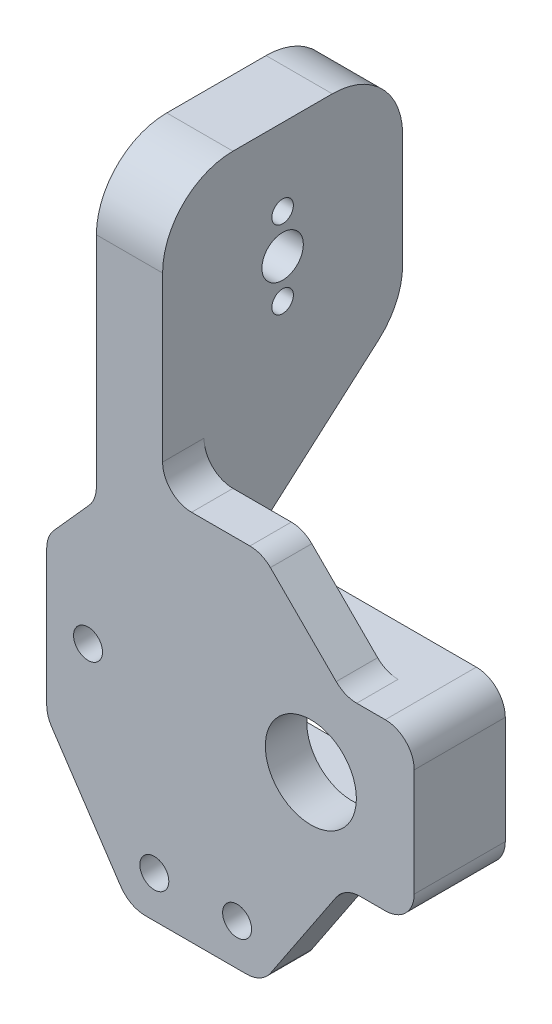
from build123d import *

# Parameters (mm, degrees)
SKETCH2_R           = 5.5
SKETCH2_R_2         = 1.750005389
SKETCH2_R_3         = 1.749978063
SKETCH2_R_4         = 1.749044057
BOSS_EXTRUDE1_DEPTH = 5
BOSS_EXTRUDE2_START = 6
SKETCH3_R           = 1
SKETCH3_W           = 23
SKETCH3_H           = 11.999999553
BOSS_EXTRUDE2_DEPTH = 6
SKETCH4_W           = 8.00000038
SKETCH4_H           = 26
BOSS_EXTRUDE3_DEPTH = 18
BOSS_EXTRUDE4_DEPTH = 4
FILLET1_R           = 8.5
SKETCH6_R           = 2.5
SKETCH6_R_2         = 1.3
CUT_EXTRUDE1_DEPTH  = 87.192574237


with BuildPart() as part:
    # Sketch2 → Boss-Extrude1 (new body)
    with BuildSketch(Plane.XY):
        with BuildLine():
            Line((6.000000052, -0.218525005), (14.000000432, -0.218525005))
            Line((14.000000432, -0.218525005), (14.000000432, -28.000000864))
            Line((14.000000432, -28.000000864), (14.000000432, -28.50000152))
            ThreePointArc((14.000000432, -28.50000152), (15.025126698, -30.974875254), (17.500000432, -32.00000152))
            Line((17.500000432, -32.00000152), (17.999999225, -32.00000152))
            Line((17.999999225, -32.00000152), (24.343099445, -32.00000152))
            Line((24.343099445, -32.00000152), (24.550253068, -32.00000152))
            ThreePointArc((24.550253068, -32.00000152), (25.889645081, -32.266423156), (27.025126802, -33.025127786))
            Line((27.025126802, -33.025127786), (27.17160061, -33.171601593))
            Line((27.17160061, -33.171601593), (34.828398377, -40.82839936))
            Line((34.828398377, -40.82839936), (34.974872184, -40.974873168))
            ThreePointArc((34.974872184, -40.974873168), (36.110353905, -41.733577798), (37.449745919, -41.999999434))
            Line((37.449745919, -41.999999434), (37.656899542, -41.999999434))
            Line((37.656899542, -41.999999434), (40.399998426, -41.999999434))
            Line((40.399998426, -41.999999434), (40.899999082, -41.999999434))
            ThreePointArc((40.899999082, -41.999999434), (43.374872816, -43.0251257), (44.399999082, -45.499999434))
            Line((44.399999082, -45.499999434), (44.399999082, -46.000000089))
            Line((44.399999082, -46.000000089), (44.399999082, -57.999998331))
            Line((44.399999082, -57.999998331), (44.399999082, -58.499998987))
            ThreePointArc((44.399999082, -58.499998987), (43.374872816, -60.974872721), (40.899999082, -61.999998987))
            Line((40.899999082, -61.999998987), (40.399998426, -61.999998987))
            Line((40.399998426, -61.999998987), (38.140699267, -61.999998987))
            Line((38.140699267, -61.999998987), (37.873109304, -61.999998987))
            ThreePointArc((37.873109304, -61.999998987), (36.221600534, -62.414141118), (34.960925686, -63.558559682))
            Line((34.960925686, -63.558559682), (34.812498838, -63.781201839))
            Line((34.812498838, -63.781201839), (27.187500149, -75.21879673))
            Line((27.187500149, -75.21879673), (27.039073301, -75.441438887))
            ThreePointArc((27.039073301, -75.441438887), (25.778398453, -76.585857451), (24.126889683, -76.999999583))
            Line((24.126889683, -76.999999583), (23.859299719, -76.999999583))
            Line((23.859299719, -76.999999583), (12.140699662, -76.999999583))
            Line((12.140699662, -76.999999583), (11.893097313, -76.999999583))
            ThreePointArc((11.893097313, -76.999999583), (10.313829571, -76.62344534), (9.074378953, -75.574807238))
            Line((9.074378953, -75.574807238), (8.814488373, -75.22173434))
            Line((8.814488373, -75.22173434), (0.671799004, -63.007697463))
            Line((0.671799004, -63.007697463), (0.587823763, -62.881734572))
            ThreePointArc((0.587823763, -62.881734572), (0.150177853, -61.954528538), (0, -60.940284196))
            Line((0, -60.940284196), (0, -60.78889966))
            Line((0, -60.78889966), (0, -44.708199799))
            Line((0, -44.708199799), (0, -44.517187636))
            ThreePointArc((0, -44.517187636), (0.230396061, -43.268312109), (0.891251475, -42.183857155))
            Line((0.891251475, -42.183857155), (1.018580049, -42.041499168))
            Line((1.018580049, -42.041499168), (4.981420003, -37.610899657))
            Line((4.981420003, -37.610899657), (5.108748578, -37.46854167))
            ThreePointArc((5.108748578, -37.46854167), (5.769603991, -36.384086716), (6.000000052, -35.135211189))
            Line((6.000000052, -35.135211189), (6.000000052, -34.944299609))
            Line((6.000000052, -34.944299609), (6.000000052, -0.218525005))
        make_face()
        with Locations((31.910091824, -52.001420952)):
            Circle(SKETCH2_R, mode=Mode.SUBTRACT)
        with Locations((22.999980116, -71.999985367)):
            Circle(SKETCH2_R_2, mode=Mode.SUBTRACT)
        with Locations((13.000012747, -72.0000118)):
            Circle(SKETCH2_R_3, mode=Mode.SUBTRACT)
        with Locations((4.995051671, -52.002868251)):
            Circle(SKETCH2_R_4, mode=Mode.SUBTRACT)
    extrude(amount=BOSS_EXTRUDE1_DEPTH)

    # Sketch3 → Boss-Extrude2 (add)
    with BuildSketch(Plane(origin=(0, 0, 0), x_dir=(-1, 0, 0), z_dir=(0, 0, -1)).offset(BOSS_EXTRUDE2_START)):
        with BuildLine():
            Line((-37.873109304, -61.999998987), (-40.899999082, -61.999998987))
            ThreePointArc((-40.899999082, -61.999998987), (-43.374872816, -60.974872721), (-44.399999082, -58.499998987))
            Line((-44.399999082, -58.499998987), (-44.399999082, -45.499999434))
            ThreePointArc((-44.399999082, -45.499999434), (-43.374872816, -43.0251257), (-40.899999082, -41.999999434))
            Line((-40.899999082, -41.999999434), (-37.449745919, -41.999999434))
            Line((-37.449745919, -41.999999434), (-17.500000432, -41.999999434))
            ThreePointArc((-17.500000432, -41.999999434), (-15.025126698, -40.974873168), (-14.000000432, -38.499999434))
            Line((-14.000000432, -38.499999434), (-14.000000432, -0.218525005))
            Line((-14.000000432, -0.218525005), (-6.000000052, -0.218525005))
            Line((-6.000000052, -0.218525005), (-6.000000052, -41.999999434))
            Line((-6.000000052, -41.999999434), (-7.399999082, -41.999999434))
            ThreePointArc((-7.399999082, -41.999999434), (-8.814212644, -42.585785871), (-9.399999082, -43.999999434))
            Line((-9.399999082, -43.999999434), (-9.399999082, -58.499998987))
            ThreePointArc((-9.399999082, -58.499998987), (-10.425125348, -60.974872721), (-12.899999082, -61.999998987))
            Line((-12.899999082, -61.999998987), (-37.873109304, -61.999998987))
        make_face()
        with Locations((-40.699999082, -51.99999921)):
            Circle(SKETCH3_R, mode=Mode.SUBTRACT)
        with Locations(Location((-13.099999082, -51.99999921, 0), (0, 0, 180))):
            Circle(SKETCH3_R, mode=Mode.SUBTRACT)
        with Locations((-26.899999082, -51.999999211)):
            Rectangle(SKETCH3_W, SKETCH3_H, mode=Mode.SUBTRACT)
    extrude(amount=-BOSS_EXTRUDE2_DEPTH)

    # Sketch4 → Boss-Extrude3 (add)
    with BuildSketch(Plane(origin=(0, 0, -6), x_dir=(-1, 0, 0), z_dir=(0, 0, -1))):
        with Locations((-10.000000242, -13.218525005)):
            Rectangle(SKETCH4_W, SKETCH4_H)
    extrude(amount=BOSS_EXTRUDE3_DEPTH)

    # Sketch5 → Boss-Extrude4 (add, symmetric)
    with BuildSketch(Plane.ZY.offset(-10.000000242)):
        Polygon((-24, -26.218525005), (-6, -41.999999434), (-6, -26.218525005), align=None)
    extrude(amount=BOSS_EXTRUDE4_DEPTH, both=True)

    # Fillet1
    fillet1_edges = [part.edges().sort_by_distance(p)[0] for p in [
        (10.000000242, -0.218525005, 5),
        (10.000000242, -26.218525005, -24),
        (10.000000242, -0.218525005, -24),
    ]]
    fillet(fillet1_edges, radius=FILLET1_R)

    # Sketch6 → Cut-Extrude1 (cut, through all)
    with BuildSketch(Plane(origin=(14.000000432, 0, 0), x_dir=(0, 0, -1), z_dir=(1, 0, 0))):
        with Locations(Location((9.49999962, -14.218525005, 0), (0, 0, 90))):
            Circle(SKETCH6_R)
        with Locations(Location((9.5, -9.518525005, 0), (0, 0, 90))):
            Circle(SKETCH6_R_2)
        with Locations((9.5, -18.918525005)):
            Circle(SKETCH6_R_2)
    extrude(amount=-CUT_EXTRUDE1_DEPTH, mode=Mode.SUBTRACT)


solid = part.part
